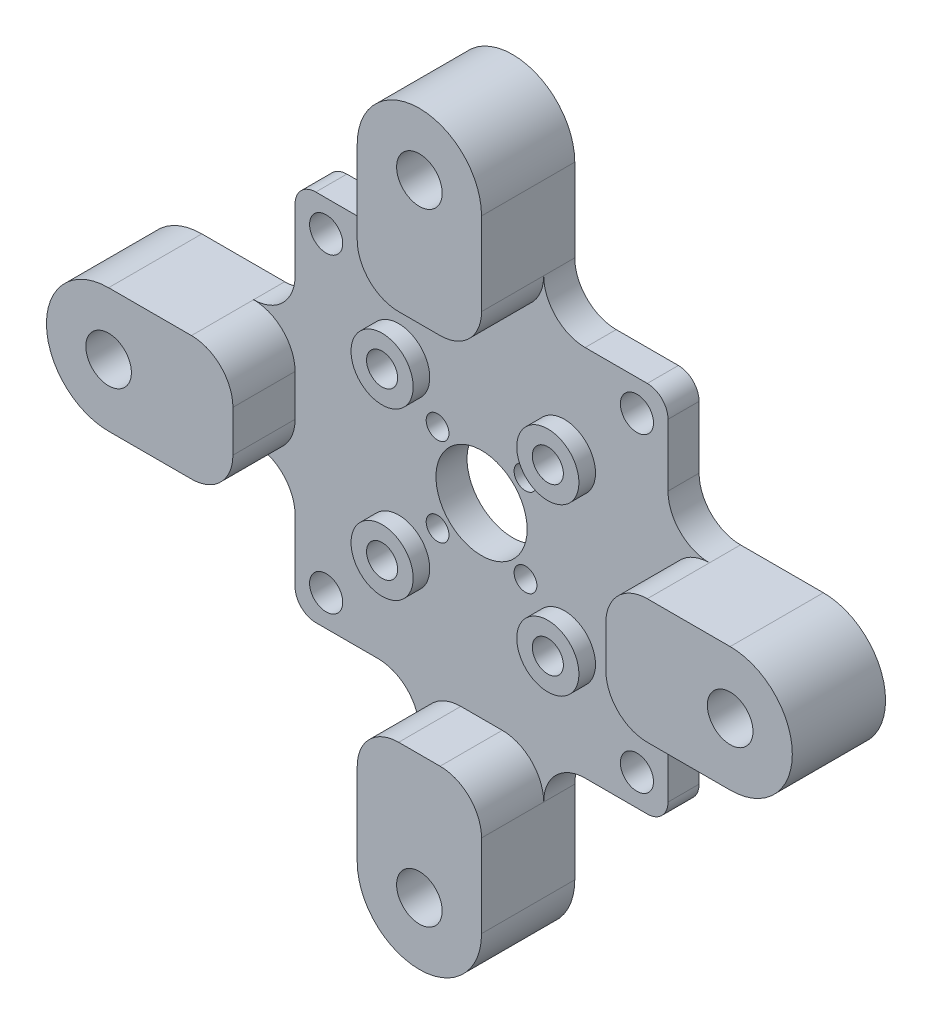
from build123d import *

# Parameters (mm, degrees)
ESQUISSE1_W             = 36
ESQUISSE1_H             = 36
ESQUISSE1_R             = 1.1
ESQUISSE1_R_2           = 4.4
ESQUISSE1_R_3           = 1.6
BOSS_EXTRU_1_DEPTH      = 3
ESQUISSE2_R             = 3
BOSS_EXTRU_2_DEPTH      = 1.6
ESQUISSE3_R             = 1.5
ENL_V_MAT_EXTRU_1_DEPTH = 26.868127107
CONG_1_R                = 2
BOSS_EXTRU_3_DEPTH      = 6
BOSS_EXTRU_3_DEPTH_BACK = 3
ESQUISSE4_R             = 2.2
CONG_2_R                = 4
CONG_3_R                = 4


with BuildPart() as part:
    # Esquisse1 → Boss.-Extru.1 (new body)
    with BuildSketch(Plane.XY):
        Rectangle(ESQUISSE1_W, ESQUISSE1_H)
        with Locations((-4.242640687, 4.242640687)):
            Circle(ESQUISSE1_R, mode=Mode.SUBTRACT)
        with Locations((4.242640687, 4.242640687)):
            Circle(ESQUISSE1_R, mode=Mode.SUBTRACT)
        with Locations((4.242640687, -4.242640687)):
            Circle(ESQUISSE1_R, mode=Mode.SUBTRACT)
        with Locations((-4.242640687, -4.242640687)):
            Circle(ESQUISSE1_R, mode=Mode.SUBTRACT)
        Circle(ESQUISSE1_R_2, mode=Mode.SUBTRACT)
        with Locations((-15, 15)):
            Circle(ESQUISSE1_R_3, mode=Mode.SUBTRACT)
        with Locations(Location((15, 15, 0), (0, 0, 180))):
            Circle(ESQUISSE1_R_3, mode=Mode.SUBTRACT)
        with Locations((15, -15)):
            Circle(ESQUISSE1_R_3, mode=Mode.SUBTRACT)
        with Locations(Location((-15, -15, 0), (0, 0, 180))):
            Circle(ESQUISSE1_R_3, mode=Mode.SUBTRACT)
    extrude(amount=BOSS_EXTRU_1_DEPTH)

    # Esquisse2 → Boss.-Extru.2 (add)
    with BuildSketch(Plane.XY.offset(3)):
        with Locations((-8, 8)):
            Circle(ESQUISSE2_R)
        with Locations((8, 8)):
            Circle(ESQUISSE2_R)
        with Locations((8, -8)):
            Circle(ESQUISSE2_R)
        with Locations((-8, -8)):
            Circle(ESQUISSE2_R)
    extrude(amount=BOSS_EXTRU_2_DEPTH)

    # Esquisse3 → Enlèv. mat.-Extru.1 (cut, through all)
    with BuildSketch(Plane.XY.offset(4.6)):
        with Locations((-8, 8)):
            Circle(ESQUISSE3_R)
        with Locations(Location((8, 8, 0), (0, 0, 180))):
            Circle(ESQUISSE3_R)
        with Locations((8, -8)):
            Circle(ESQUISSE3_R)
        with Locations(Location((-8, -8, 0), (0, 0, 180))):
            Circle(ESQUISSE3_R)
    extrude(amount=-ENL_V_MAT_EXTRU_1_DEPTH, mode=Mode.SUBTRACT)

    # Congé1
    cong_1_edges = [part.edges().sort_by_distance(p)[0] for p in [
        (-18, 18, 1.5),
        (18, 18, 1.5),
        (18, -18, 1.5),
        (-18, -18, 1.5),
    ]]
    fillet(cong_1_edges, radius=CONG_1_R)

    # Esquisse4 → Boss.-Extru.3 (add, two sides: drawn at the far end of the back side and taken through both)
    # profile 1 of 4: a face of its own
    with BuildSketch(Plane.XY.offset(3).offset(-BOSS_EXTRU_3_DEPTH_BACK)):
        with BuildLine():
            Line((-6, 30), (-6, 18))
            Line((-6, 18), (6, 18))
            Line((6, 18), (6, 30))
            ThreePointArc((6, 30), (0, 36), (-6, 30))
        make_face()
        with Locations((0, 30)):
            Circle(ESQUISSE4_R, mode=Mode.SUBTRACT)
    # profile 2 of 4: a face of its own
    with BuildSketch(Plane.XY.offset(3).offset(-BOSS_EXTRU_3_DEPTH_BACK)):
        with BuildLine():
            Line((30, 6), (18, 6))
            Line((18, 6), (18, -6))
            Line((18, -6), (30, -6))
            ThreePointArc((30, -6), (36, 0), (30, 6))
        make_face()
        with Locations((30, 0)):
            Circle(ESQUISSE4_R, mode=Mode.SUBTRACT)
    # profile 3 of 4: a face of its own
    with BuildSketch(Plane.XY.offset(3).offset(-BOSS_EXTRU_3_DEPTH_BACK)):
        with BuildLine():
            Line((6, -30), (6, -18))
            Line((6, -18), (-6, -18))
            Line((-6, -18), (-6, -30))
            ThreePointArc((-6, -30), (0, -36), (6, -30))
        make_face()
        with Locations((0, -30)):
            Circle(ESQUISSE4_R, mode=Mode.SUBTRACT)
    # profile 4 of 4: a face of its own
    with BuildSketch(Plane.XY.offset(3).offset(-BOSS_EXTRU_3_DEPTH_BACK)):
        with BuildLine():
            Line((-30, -6), (-18, -6))
            Line((-18, -6), (-18, 6))
            Line((-18, 6), (-30, 6))
            ThreePointArc((-30, 6), (-36, 0), (-30, -6))
        make_face()
        with Locations((-30, 0)):
            Circle(ESQUISSE4_R, mode=Mode.SUBTRACT)
    extrude(amount=BOSS_EXTRU_3_DEPTH + BOSS_EXTRU_3_DEPTH_BACK)

    # Congé2
    cong_2_edges = [part.edges().sort_by_distance(p)[0] for p in [
        (6, 18, 6),
        (-6, 18, 6),
        (18, -6, 6),
        (18, 6, 6),
        (-6, -18, 6),
        (6, -18, 6),
        (-18, 6, 6),
        (-18, -6, 6),
    ]]
    fillet(cong_2_edges, radius=CONG_2_R)

    # Congé3
    cong_3_edges = [part.edges().sort_by_distance(p)[0] for p in [
        (18, -6, 1.5),
        (18, 6, 1.5),
        (6, 18, 1.5),
        (-6, 18, 1.5),
        (-18, 6, 1.5),
        (-18, -6, 1.5),
        (-6, -18, 1.5),
        (6, -18, 1.5),
    ]]
    fillet(cong_3_edges, radius=CONG_3_R)


solid = part.part
